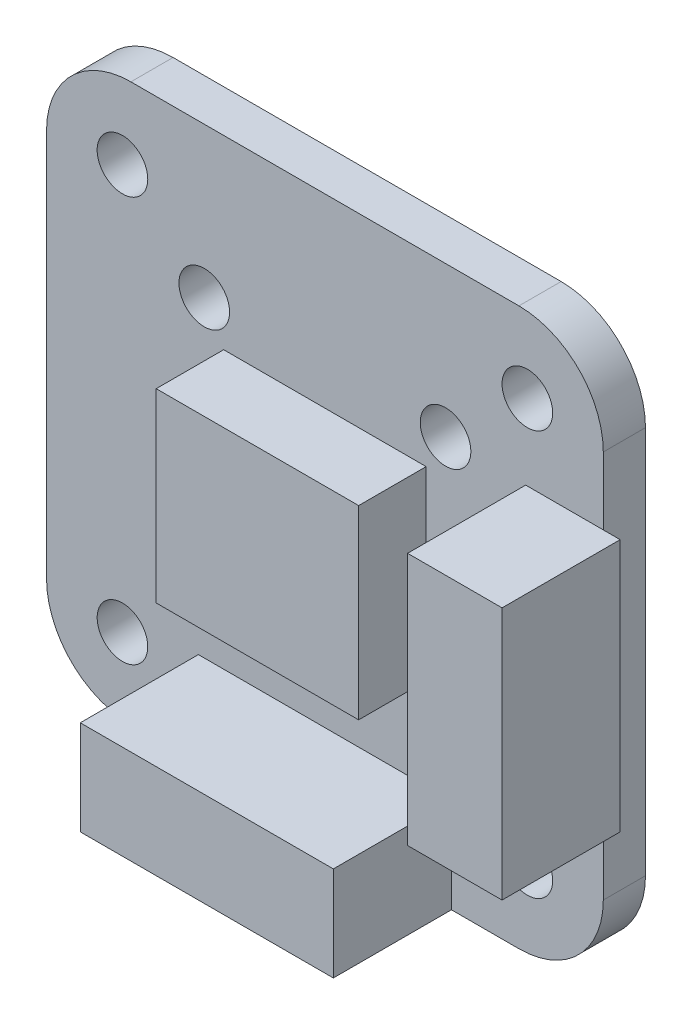
from build123d import *

# Parameters (mm, degrees)
SKETCH1_W           = 33
SKETCH1_H           = 33
SKETCH1_R           = 1.5
BOSS_EXTRUDE1_DEPTH = 2.5
FILLET1_R           = 5
SKETCH2_W           = 15
SKETCH2_H           = 5.6
SKETCH2_W_2         = 5.6
SKETCH2_H_2         = 15
BOSS_EXTRUDE2_DEPTH = 7
SKETCH3_W           = 12
SKETCH3_H           = 11
BOSS_EXTRUDE3_DEPTH = 4


with BuildPart() as part:
    # Sketch1 → Boss-Extrude1 (new body)
    with BuildSketch(Plane.XY):
        with Locations((-3.4417913, -5.340458015)):
            Rectangle(SKETCH1_W, SKETCH1_H)
        with Locations((-15.4417913, 6.659541985)):
            Circle(SKETCH1_R, mode=Mode.SUBTRACT)
        with Locations(Location((8.5582087, 6.659541985, 0), (0, 0, 180))):
            Circle(SKETCH1_R, mode=Mode.SUBTRACT)
        with Locations(Location((-15.4417913, -17.340458015, 0), (0, 0, 180))):
            Circle(SKETCH1_R, mode=Mode.SUBTRACT)
        with Locations((8.5582087, -17.340458015)):
            Circle(SKETCH1_R, mode=Mode.SUBTRACT)
        with Locations((-10.5917913, -12.940458015)):
            Circle(SKETCH1_R, mode=Mode.SUBTRACT)
        with Locations(Location((3.7082087, -12.940458015, 0), (0, 0, 180))):
            Circle(SKETCH1_R, mode=Mode.SUBTRACT)
        with Locations(Location((-10.5917913, 2.259541985, 0), (0, 0, 180))):
            Circle(SKETCH1_R, mode=Mode.SUBTRACT)
        with Locations((3.7082087, 2.259541985)):
            Circle(SKETCH1_R, mode=Mode.SUBTRACT)
    extrude(amount=BOSS_EXTRUDE1_DEPTH)

    # Fillet1
    fillet1_edges = [part.edges().sort_by_distance(p)[0] for p in [
        (-19.9417913, 11.159541985, 1.25),
        (13.0582087, 11.159541985, 1.25),
        (13.0582087, -21.840458015, 1.25),
        (-19.9417913, -21.840458015, 1.25),
    ]]
    fillet(fillet1_edges, radius=FILLET1_R)

    # Sketch2 → Boss-Extrude2 (add)
    with BuildSketch(Plane.XY.offset(2.5)):
        with Locations((-3.4417913, -19.040458015)):
            Rectangle(SKETCH2_W, SKETCH2_H)
        with Locations((11.2582087, -5.340458015)):
            Rectangle(SKETCH2_W_2, SKETCH2_H_2)
    extrude(amount=BOSS_EXTRUDE2_DEPTH)

    # Sketch3 → Boss-Extrude3 (add)
    with BuildSketch(Plane.XY.offset(2.5)):
        with Locations((-3.4417913, -5.340458015)):
            Rectangle(SKETCH3_W, SKETCH3_H)
    extrude(amount=BOSS_EXTRUDE3_DEPTH)


solid = part.part
